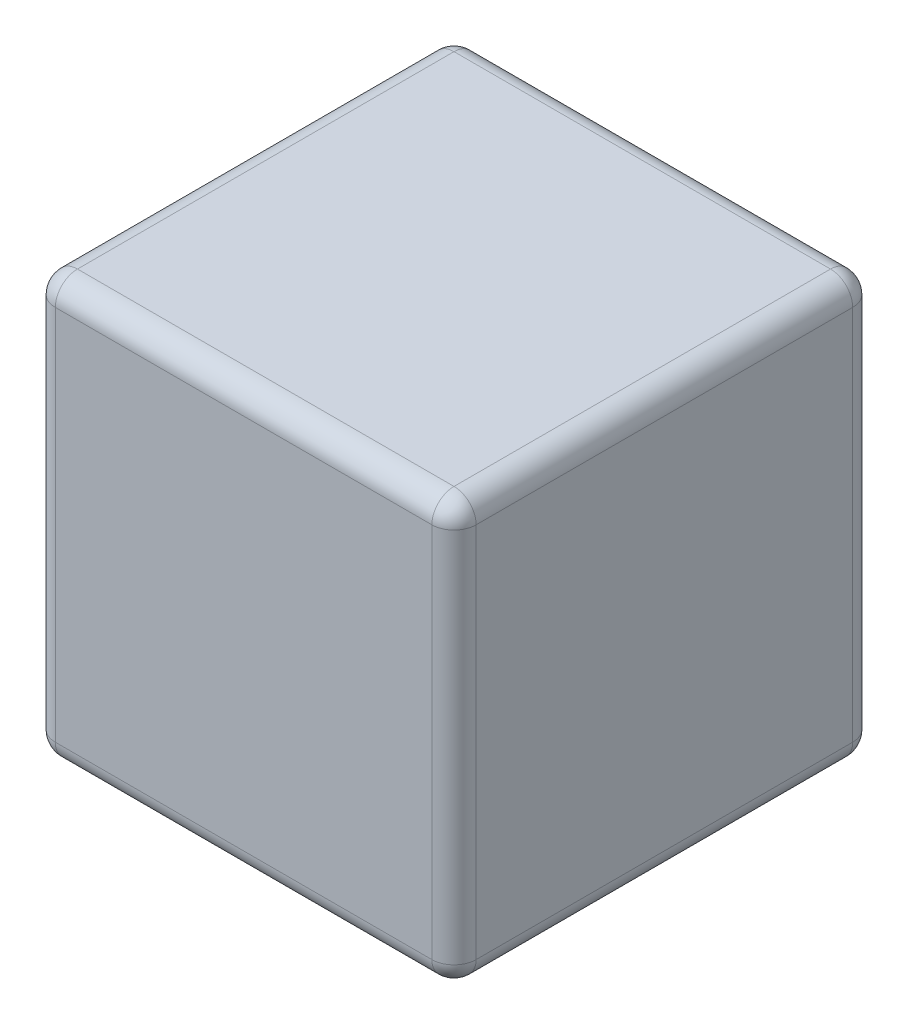
from build123d import *

# Parameters (mm, degrees)
SKETCH1_W           = 241.3
SKETCH1_H           = 241.3
BOSS_EXTRUDE1_DEPTH = 241.3
FILLET1_R           = 12.7


with BuildPart() as part:
    # Sketch1 → Boss-Extrude1 (new body)
    with BuildSketch(Plane.XY):
        with Locations((1076.569230769, -9.280769231)):
            Rectangle(SKETCH1_W, SKETCH1_H)
    extrude(amount=BOSS_EXTRUDE1_DEPTH)

    # Fillet1
    fillet1_edges = [part.edges().sort_by_distance(p)[0] for p in [
        (1197.219230769, -9.280769231, 241.3),
        (1076.569230769, 111.369230769, 241.3),
        (955.919230769, -9.280769231, 241.3),
        (1076.569230769, 111.369230769, 0),
        (1197.219230769, -9.280769231, 0),
        (1076.569230769, -129.930769231, 0),
        (955.919230769, -9.280769231, 0),
        (955.919230769, 111.369230769, 120.65),
        (1197.219230769, 111.369230769, 120.65),
        (1197.219230769, -129.930769231, 120.65),
        (955.919230769, -129.930769231, 120.65),
        (1076.569230769, -129.930769231, 241.3),
    ]]
    fillet(fillet1_edges, radius=FILLET1_R)


solid = part.part
